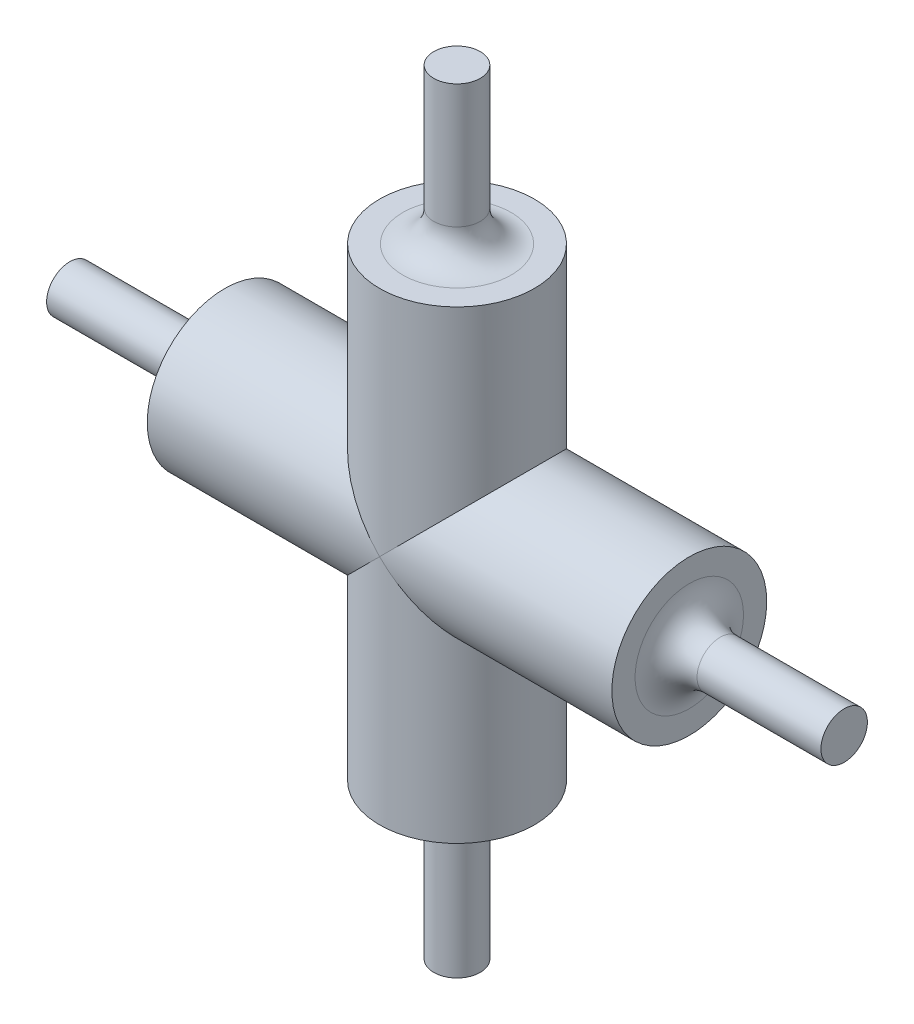
from build123d import *

# Parameters (mm, degrees)
SKETCH_1_R                       = 10
EXTRUDE_1_DEPTH                  = 50
SKETCH_2_R                       = 10
EXTRUDE_2_DEPTH                  = 50
SKETCH_3_OUTSIDE_W               = 50.566
SKETCH_3_OUTSIDE_H               = 130.566
SKETCH_3_OUTSIDE_R               = 3
CUT_EXTRUDE_1_DEPTH              = 20
FILLET_2_R                       = 4
PATTERN_CIRCULAR_1_COUNT         = 4
FILLET_2_OF_PATTERN_CIRCULAR_1_R = 4


with BuildPart() as part:
    # 草图1 → 凸台-拉伸1 (new, symmetric)
    with BuildSketch(Plane(origin=(0, 0, 0), x_dir=(1, 0, 0), z_dir=(0, 1, 0))):
        Circle(SKETCH_1_R)
    extrude(amount=EXTRUDE_1_DEPTH, both=True)

    # 草图2 → 凸台-拉伸2 (add, symmetric)
    with BuildSketch(Plane(origin=(0, 0, 0), x_dir=(0, 0, -1), z_dir=(1, 0, 0))):
        Circle(SKETCH_2_R)
    extrude(amount=EXTRUDE_2_DEPTH, both=True)

    # 草图3 outside → 切除-拉伸1 (cut)
    with BuildSketch(Plane.ZY.offset(50)):
        Rectangle(SKETCH_3_OUTSIDE_W, SKETCH_3_OUTSIDE_H)
        Circle(SKETCH_3_OUTSIDE_R, mode=Mode.SUBTRACT)
    cut_extrude_1 = extrude(amount=-CUT_EXTRUDE_1_DEPTH, mode=Mode.SUBTRACT)

    # 圆角2
    fillet_2_edges = [part.edges().sort_by_distance(p)[0] for p in [
        (-30, 0, -3),
    ]]
    fillet(fillet_2_edges, radius=FILLET_2_R)

    # 阵列(圆周)1: 切除-拉伸1 ×4 about axis
    pattern_circular_1_axis = Axis((0, 0, 11), (0, 0, -1))
    for i in range(1, PATTERN_CIRCULAR_1_COUNT):
        add(cut_extrude_1.rotate(pattern_circular_1_axis, i * 360 / PATTERN_CIRCULAR_1_COUNT), mode=Mode.SUBTRACT)

    # 圆角2 of 阵列(圆周)1
    fillet_2_of_pattern_circular_1_edges = [part.edges().sort_by_distance(p)[0] for p in [
        (0, 30, -3),
        (30, 0, -3),
        (0, -30, -3),
    ]]
    fillet(fillet_2_of_pattern_circular_1_edges, radius=FILLET_2_OF_PATTERN_CIRCULAR_1_R)


solid = part.part
